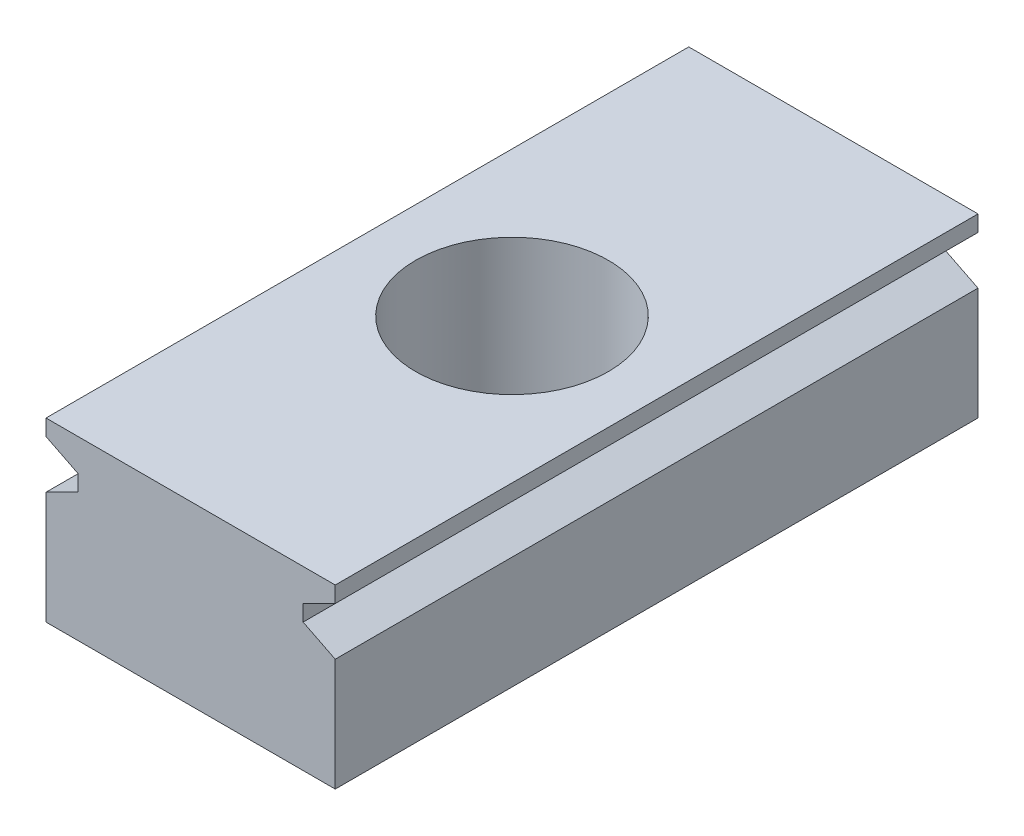
from build123d import *

# Parameters (mm, degrees)
BOSS_EXTRU_1_DEPTH      = 20
ESQUISSE2_R             = 3
ENL_V_MAT_EXTRU_1_DEPTH = 4.5
ESQUISSE3_R             = 1.75
ENL_V_MAT_EXTRU_2_DEPTH = 21.988091862


with BuildPart() as part:
    # Esquisse1 → Boss.-Extru.1 (new body)
    with BuildSketch(Plane.XY):
        Polygon((-4.5, 0), (4.5, 0), (4.5, 3.5), (3.5, 4), (3.5, 4.5), (4.5, 5), (4.5, 5.5), (-4.5, 5.5), (-4.5, 5), (-3.5, 4.5), (-3.5, 4), (-4.5, 3.5), align=None)
    extrude(amount=BOSS_EXTRU_1_DEPTH)

    # Esquisse2 → Enlèv. mat.-Extru.1 (cut)
    with BuildSketch(Plane(origin=(0, 5.5, 0), x_dir=(1, 0, 0), z_dir=(0, 1, 0))):
        with Locations(Location((0, -10, 0), (0, 0, 180))):
            Circle(ESQUISSE2_R)
    extrude(amount=-ENL_V_MAT_EXTRU_1_DEPTH, mode=Mode.SUBTRACT)

    # Esquisse3 → Enlèv. mat.-Extru.2 (cut, through all)
    with BuildSketch(Plane(origin=(0, 1, 0), x_dir=(1, 0, 0), z_dir=(0, 1, 0))):
        with Locations(Location((0, -10, 0), (0, 0, 180))):
            Circle(ESQUISSE3_R)
    extrude(amount=-ENL_V_MAT_EXTRU_2_DEPTH, mode=Mode.SUBTRACT)


solid = part.part
